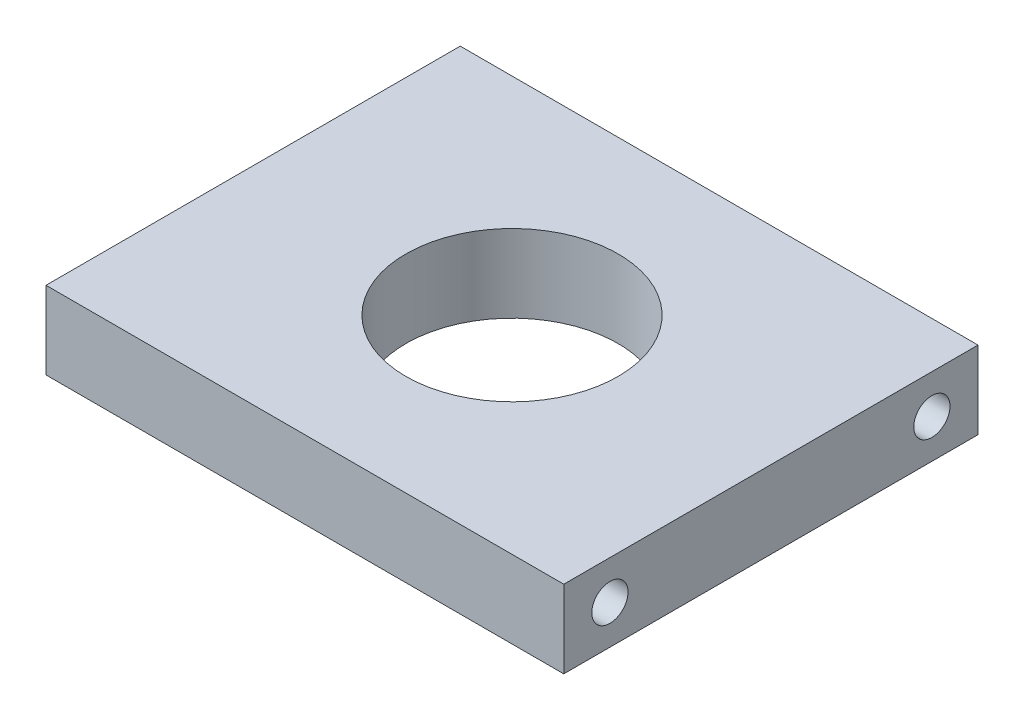
from build123d import *

# Parameters (mm, degrees)
SKETCH1_W           = 100
SKETCH1_H           = 80
SKETCH1_R           = 20.5
BOSS_EXTRUDE1_DEPTH = 15
SKETCH2_R           = 3.5
CUT_EXTRUDE1_DEPTH  = 100


with BuildPart() as part:
    # Sketch1 → Boss-Extrude1 (new body)
    with BuildSketch(Plane(origin=(0, 0, 0), x_dir=(1, 0, 0), z_dir=(0, 1, 0))):
        Rectangle(SKETCH1_W, SKETCH1_H)
        with Locations(Location((0, 0, 0), (0, 0, 270))):
            Circle(SKETCH1_R, mode=Mode.SUBTRACT)
    extrude(amount=BOSS_EXTRUDE1_DEPTH)

    # Sketch2 → Cut-Extrude1 (cut)
    with BuildSketch(Plane(origin=(50, 0, 0), x_dir=(0, 0, -1), z_dir=(1, 0, 0))):
        with Locations((-31.091464528, 7.5)):
            Circle(SKETCH2_R)
        with Locations(Location((31.091464528, 7.5, 0), (0, 0, 180))):
            Circle(SKETCH2_R)
    extrude(amount=-CUT_EXTRUDE1_DEPTH, mode=Mode.SUBTRACT)


solid = part.part
